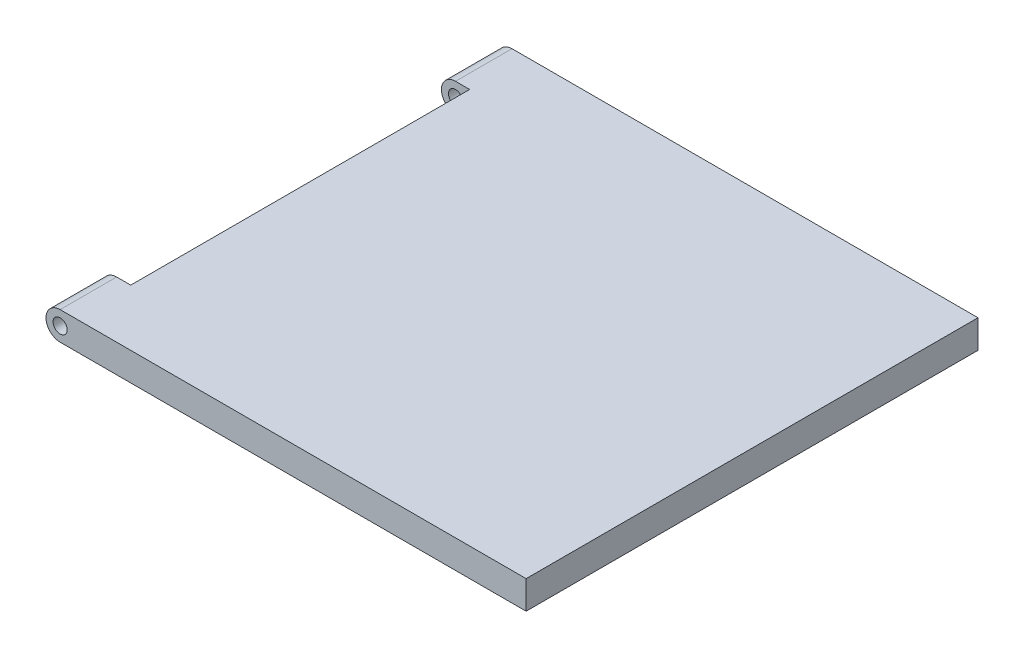
from build123d import *

# Parameters (mm, degrees)
BOSS_EXTRUDE1_DEPTH     = 40
BOSS_EXTRUDE2_START     = 30
SKETCH2_R               = 1.25
BOSS_EXTRUDE2_DEPTH     = 10
CUT_EXTRUDE1_DEPTH      = 91
CUT_EXTRUDE1_DEPTH_BACK = 91
SKETCH3_W               = 5
SKETCH3_H               = 5


with BuildPart() as part:
    # Sketch1 → Boss-Extrude1 (new, symmetric)
    with BuildSketch(Plane.XY):
        Polygon((0, 0), (80, 0), (80, 10), (75, 10), (75, 5), (0, 5), align=None)
    extrude(amount=BOSS_EXTRUDE1_DEPTH, both=True)

    # Sketch2 → Boss-Extrude2 (add)
    with BuildSketch(Plane.XY.offset(BOSS_EXTRUDE2_START)):
        with BuildLine():
            Line((0, 5), (-2.5, 5))
            ThreePointArc((-2.5, 5), (-5, 2.5), (-2.5, 0))
            Line((-2.5, 0), (0, 0))
            Line((0, 0), (0, 5))
        make_face()
        with Locations((-2.5, 2.5)):
            Circle(SKETCH2_R, mode=Mode.SUBTRACT)
    boss_extrude2 = extrude(amount=BOSS_EXTRUDE2_DEPTH)

    # Mirror2: Boss-Extrude2 across plane
    add(boss_extrude2.mirror(Plane.XY))

    # Sketch3 → Cut-Extrude1 (cut, two sides: drawn at the far end of the back side and taken through both)
    with BuildSketch(Plane.XY.offset(-CUT_EXTRUDE1_DEPTH_BACK)):
        with Locations((77.5, 7.5)):
            Rectangle(SKETCH3_W, SKETCH3_H)
    extrude(amount=CUT_EXTRUDE1_DEPTH + CUT_EXTRUDE1_DEPTH_BACK, mode=Mode.SUBTRACT)


solid = part.part
